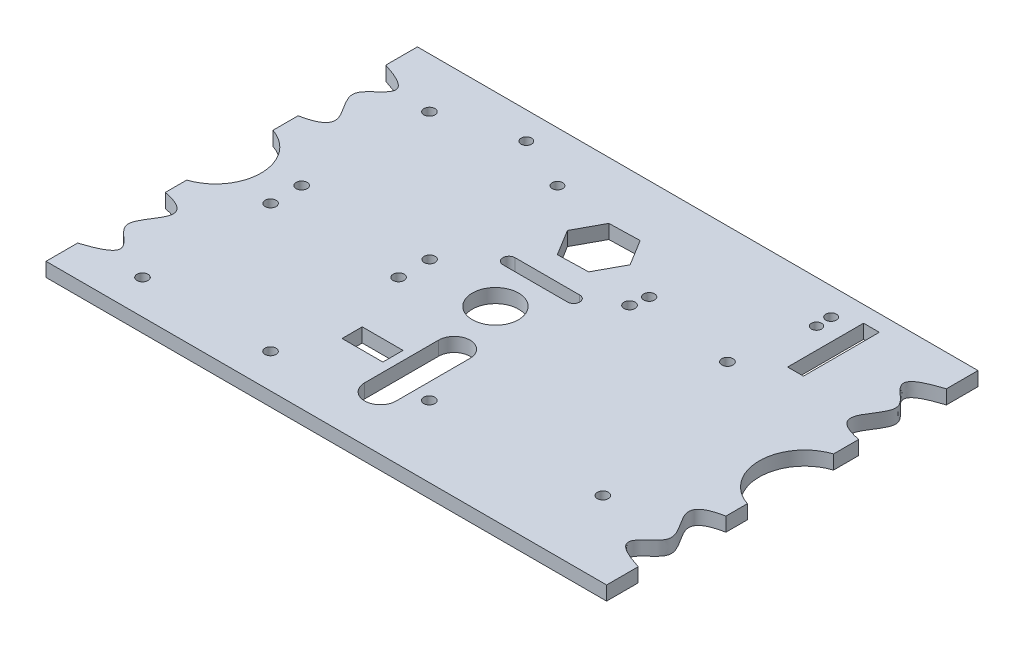
from build123d import *

# Parameters (mm, degrees)
SKETCH1_R           = 1.572651685
SKETCH1_W           = 11.644038646
SKETCH1_H           = 5.765279756
SKETCH1_R_2         = 1.5875
SKETCH1_R_3         = 1.573453894
SKETCH1_R_4         = 1.559986851
SKETCH1_R_5         = 6.598413588
SKETCH1_R_6         = 1.572849618
SKETCH1_R_7         = 1.499975878
SKETCH1_R_8         = 1.537647246
SKETCH1_W_2         = 4.506321673
SKETCH1_H_2         = 21.672357955
SKETCH1_R_9         = 1.455342512
BOSS_EXTRUDE1_DEPTH = 4


with BuildPart() as part:
    # Sketch1 → Boss-Extrude1 (new body)
    with BuildSketch(Plane(origin=(0, 0, 0), x_dir=(1, 0, 0), z_dir=(0, 1, 0))):
        with BuildLine():
            Line((80, 43.971671866), (80, 53))
            Line((80, 53), (-80, 53))
            Line((-80, 53), (-80, 43.971671866))
            add(Edge.make_bspline(
                [(-80, 43.971671866), (-65.385653613, 39.40479143), (-89.077453909, 33.627557401), (-66.52691334, 21.603012731), (-80, 18.948157225)],
                knots=[0, 0, 0, 0, 0.464080818, 1, 1, 1, 1], degree=3))
            Line((-80, 18.948157225), (-80, 11.773195968))
            ThreePointArc((-80, 11.773195968), (-71.103660502, -0.526648314), (-80, -12.826492596))
            Line((-80, -12.826492596), (-80, -16.469279615))
            Line((-80, -16.469279615), (-80, -18.948157225))
            add(Edge.make_bspline(
                [(-80, -43.971671866), (-65.385653613, -39.40479143), (-89.077453909, -33.627557401), (-66.52691334, -21.603012731), (-80, -18.948157225)],
                knots=[0, 0, 0, 0, 0.464080818, 1, 1, 1, 1], degree=3))
            Line((-80, -43.971671866), (-80, -48.36784463))
            Line((-80, -48.36784463), (-80, -53))
            Line((-80, -53), (80, -53))
            Line((80, -53), (80, -43.971671866))
            add(Edge.make_bspline(
                [(80, -43.971671866), (65.385653613, -39.40479143), (89.077453909, -33.627557401), (66.52691334, -21.603012731), (80, -18.948157225)],
                knots=[0, 0, 0, 0, 0.464080818, 1, 1, 1, 1], degree=3))
            Line((80, -18.948157225), (80, -12.826492596))
            ThreePointArc((80, -12.826492596), (71.103660502, -0.526648314), (80, 11.773195968))
            Line((80, 11.773195968), (80, 18.948157225))
            add(Edge.make_bspline(
                [(80, 43.971671866), (65.385653613, 39.40479143), (89.077453909, 33.627557401), (66.52691334, 21.603012731), (80, 18.948157225)],
                knots=[0, 0, 0, 0, 0.464080818, 1, 1, 1, 1], degree=3))
        make_face()
        with Locations(Location((-62.250436779, -43.20843745, 0), (0, 0, 270))):
            Circle(SKETCH1_R, mode=Mode.SUBTRACT)
        with Locations(Location((-25.714592034, -43.20843745, 0), (0, 0, 270))):
            Circle(SKETCH1_R, mode=Mode.SUBTRACT)
        with Locations((-12.847001436, -26.953726478)):
            Rectangle(SKETCH1_W, SKETCH1_H, mode=Mode.SUBTRACT)
        with Locations(Location((-62.250436779, -6.647294825, 0), (0, 0, 270))):
            Circle(SKETCH1_R, mode=Mode.SUBTRACT)
        with Locations(Location((-25.714592034, -6.647294825, 0), (0, 0, 270))):
            Circle(SKETCH1_R, mode=Mode.SUBTRACT)
        with Locations(Location((9.080460795, -32.68, 0), (0, 0, 270))):
            Circle(SKETCH1_R_2, mode=Mode.SUBTRACT)
        with BuildLine():
            ThreePointArc((4.499768913, -37.552295579), (0, -42.052064492), (-4.499768913, -37.552295579))
            Line((-4.499768913, -37.552295579), (-4.499768913, -16.469279615))
            ThreePointArc((-4.499768913, -16.469279615), (0, -11.969510703), (4.499768913, -16.469279615))
            Line((4.499768913, -16.469279615), (4.499768913, -37.552295579))
        make_face(mode=Mode.SUBTRACT)
        with Locations(Location((57.340460795, -31.41, 0), (0, 0, 270))):
            Circle(SKETCH1_R_2, mode=Mode.SUBTRACT)
        with Locations(Location((-62.250436779, 2.210073291, 0), (0, 0, 270))):
            Circle(SKETCH1_R_3, mode=Mode.SUBTRACT)
        with Locations(Location((-25.714592034, 2.210073291, 0), (0, 0, 270))):
            Circle(SKETCH1_R_4, mode=Mode.SUBTRACT)
        with Locations(Location((-4.725453474, 0, 0), (0, 0, 270))):
            Circle(SKETCH1_R_5, mode=Mode.SUBTRACT)
        with BuildLine():
            ThreePointArc((4.499768913, 14.833404805), (6.242806414, 13.090367304), (4.499768913, 11.347329803))
            Line((4.499768913, 11.347329803), (-13.950675862, 11.347329803))
            ThreePointArc((-13.950675862, 11.347329803), (-15.693713363, 13.090367304), (-13.950675862, 14.833404805))
            Line((-13.950675862, 14.833404805), (4.499768913, 14.833404805))
        make_face(mode=Mode.SUBTRACT)
        with Locations(Location((-62.250436779, 38.687345787, 0), (0, 0, 270))):
            Circle(SKETCH1_R_6, mode=Mode.SUBTRACT)
        with BuildLine():
            add(Edge.make_bspline(
                [(-39.652356334, 45.238000012), (-39.652356334, 48.238000012), (-42.652356334, 48.238000012), (-42.652356334, 45.238000012), (-42.652356334, 42.238000012), (-39.652356334, 42.238000012), (-39.652356334, 45.238000012)],
                knots=[0, 0, 0, 0, 0.5, 0.5, 0.5, 1, 1, 1, 1], degree=3, weights=[1, 0.333333333, 0.333333333, 1, 0.333333333, 0.333333333, 1]))
        make_face(mode=Mode.SUBTRACT)
        with Locations(Location((-25.714592034, 38.687345787, 0), (0, 0, 270))):
            Circle(SKETCH1_R_7, mode=Mode.SUBTRACT)
        Polygon((0.058166934, 21.830550018), (-8.655922933, 21.598581172), (-13.21385878, 29.029219944), (-9.05770476, 36.691827563), (-0.343614893, 36.923796409), (4.214320954, 29.493157636), align=None, mode=Mode.SUBTRACT)
        with Locations(Location((14.160460795, 19.39, 0), (0, 0, 270))):
            Circle(SKETCH1_R_2, mode=Mode.SUBTRACT)
        with Locations(Location((14.894900679, 24.261040082, 0), (0, 0, 270))):
            Circle(SKETCH1_R_8, mode=Mode.SUBTRACT)
        with Locations(Location((42.100460795, 19.39, 0), (0, 0, 270))):
            Circle(SKETCH1_R_2, mode=Mode.SUBTRACT)
        with Locations((54.219607529, 37.531665653)):
            Rectangle(SKETCH1_W_2, SKETCH1_H_2, mode=Mode.SUBTRACT)
        with Locations(Location((45.983391129, 40.924373364, 0), (0, 0, 270))):
            Circle(SKETCH1_R_9, mode=Mode.SUBTRACT)
        with BuildLine():
            add(Edge.make_bspline(
                [(47.342643666, 45.238000012), (47.342643666, 48.238000012), (44.342643666, 48.238000012), (44.342643666, 45.238000012), (44.342643666, 42.238000012), (47.342643666, 42.238000012), (47.342643666, 45.238000012)],
                knots=[0, 0, 0, 0, 0.5, 0.5, 0.5, 1, 1, 1, 1], degree=3, weights=[1, 0.333333333, 0.333333333, 1, 0.333333333, 0.333333333, 1]))
        make_face(mode=Mode.SUBTRACT)
    extrude(amount=BOSS_EXTRUDE1_DEPTH)


solid = part.part
